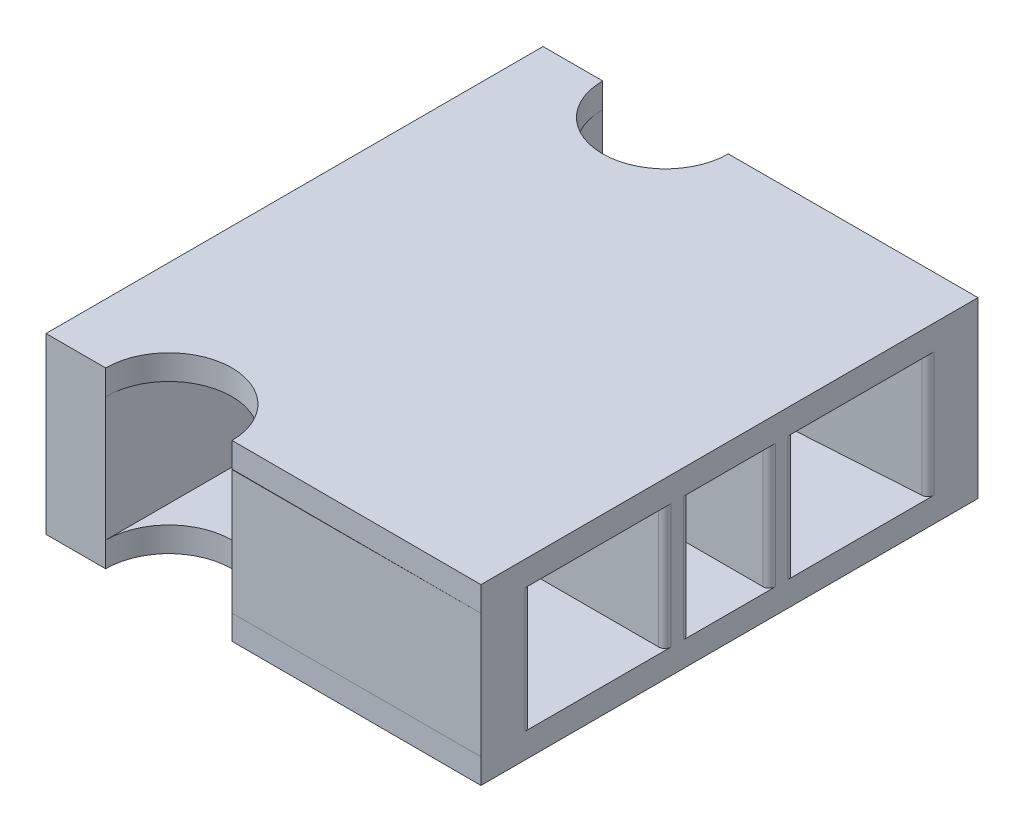
from build123d import *

# Parameters (mm, degrees)
SALIENTE_EXTRUIR1_DEPTH   = 5
SALIENTE_EXTRUIR1_2_DEPTH = 5
CROQUIS1_W                = 4.860345515
CROQUIS1_H                = 40
SALIENTE_EXTRUIR1_3_DEPTH = 5
SALIENTE_EXTRUIR2_DEPTH   = 2
REDONDEO1_R               = 0.5
REDONDEO2_R               = 0.5
REDONDEO3_R               = 0.5
CROQUIS5_W                = 30.200510783
CROQUIS5_H                = 2
SALIENTE_EXTRUIR3_DEPTH   = 5
REDONDEO4_R               = 0.5
CROQUIS6_W                = 0.06
CROQUIS6_H                = 40
CORTAR_EXTRUIR4_DEPTH     = 17


with BuildPart() as part:
    # Croquis1 → Saliente-Extruir1 (new, symmetric)
    with BuildSketch(Plane(origin=(0, 0, 0), x_dir=(1, 0, 0), z_dir=(0, 1, 0))):
        Polygon((17.530428149, 19.999144472), (-2.49913463, 19.999144472), (-2.53039772, 19.968072403), (-2.53039772, 14.718192691), (17.530428149, 16.000273752), align=None)
    extrude(amount=SALIENTE_EXTRUIR1_DEPTH, both=True)



with BuildPart() as body_2:
    # Croquis1 → Saliente-Extruir1 2 (new, symmetric)
    with BuildSketch(Plane(origin=(0, 0, 0), x_dir=(1, 0, 0), z_dir=(0, 1, 0))):
        Polygon((17.530428149, -20.000855528), (-2.49913463, -20.000855528), (-2.530548466, -19.969634553), (-2.530548466, -14.710829577), (17.530428149, -15.997364244), align=None)
    extrude(amount=SALIENTE_EXTRUIR1_2_DEPTH, both=True)


with BuildPart() as body_3:
    # Croquis1 → Saliente-Extruir1 3 (new, symmetric)
    with BuildSketch(Plane(origin=(0, 0, 0), x_dir=(1, 0, 0), z_dir=(0, 1, 0))):
        with Locations((-15.100255392, -0.000855528)):
            Rectangle(CROQUIS1_W, CROQUIS1_H)
    extrude(amount=SALIENTE_EXTRUIR1_3_DEPTH, both=True)


with BuildPart() as part_1:
    add(part.part)

    add(body_2.part)  # Saliente-Extruir2 merges body 2

    add(body_3.part)  # Saliente-Extruir2 merges body 3
    # Croquis3 → Saliente-Extruir2 (add)
    with BuildSketch(Plane(origin=(0, 5, 0), x_dir=(1, 0, 0), z_dir=(0, 1, 0))):
        with BuildLine():
            Line((-17.530428149, 19.999144472), (-12.670082634, 19.999144472))
            ThreePointArc((-12.670082634, 19.999144472), (-7.615776211, 14.91376598), (-2.53039772, 19.968072403))
            Line((-2.53039772, 19.968072403), (17.530428149, 19.999144472))
            Line((17.530428149, 19.999144472), (17.530428149, -20.000855528))
            Line((17.530428149, -20.000855528), (-2.530548466, -19.969634553))
            ThreePointArc((-2.530548466, -19.969634553), (-7.615926037, -14.915477956), (-12.670082634, -20.000855528))
            Line((-12.670082634, -20.000855528), (-17.530428149, -20.000855528))
            Line((-17.530428149, -20.000855528), (-17.530428149, 19.999144472))
        make_face()
    saliente_extruir2 = extrude(amount=SALIENTE_EXTRUIR2_DEPTH)

    # Simetría1: Saliente-Extruir2 across plane
    add(saliente_extruir2.mirror(Plane.ZX))

    # Redondeo1
    redondeo1_edges = [part_1.edges().sort_by_distance(p)[0] for p in [
        (-2.530548466, 0, 14.710829577),
    ]]
    fillet(redondeo1_edges, radius=REDONDEO1_R)

    # Redondeo2
    redondeo2_edges = [part_1.edges().sort_by_distance(p)[0] for p in [
        (-2.53039772, 0, -14.718192691),
    ]]
    fillet(redondeo2_edges, radius=REDONDEO2_R)

    # Redondeo3
    redondeo3_edges = [part_1.edges().sort_by_distance(p)[0] for p in [
        (17.530428149, 0, 15.997364244),
        (17.530428149, 0, -16.000273752),
    ]]
    fillet(redondeo3_edges, radius=REDONDEO3_R)

    # Croquis5 → Saliente-Extruir3 (add, symmetric)
    with BuildSketch(Plane(origin=(0, 0, 0), x_dir=(1, 0, 0), z_dir=(0, 1, 0))):
        with Locations((2.430172758, -4.198493404)):
            Rectangle(CROQUIS5_W, CROQUIS5_H)
        with Locations((2.430172758, 4.201506596)):
            Rectangle(CROQUIS5_W, CROQUIS5_H)
    extrude(amount=SALIENTE_EXTRUIR3_DEPTH, both=True)

    # Redondeo4
    redondeo4_edges = [part_1.edges().sort_by_distance(p)[0] for p in [
        (17.530428149, 0, -3.201506596),
        (17.530428149, 0, -5.201506596),
        (17.530428149, 0, 5.198493404),
        (17.530428149, 0, 3.198493404),
    ]]
    fillet(redondeo4_edges, radius=REDONDEO4_R)

    # Croquis6 → Cortar-Extruir4 (cut)
    with BuildSketch(Plane(origin=(0, 7, 0), x_dir=(1, 0, 0), z_dir=(0, 1, 0))):
        with Locations((-17.500428149, -0.000855528)):
            Rectangle(CROQUIS6_W, CROQUIS6_H)
    extrude(amount=-CORTAR_EXTRUIR4_DEPTH, mode=Mode.SUBTRACT)


solid = part_1.part
